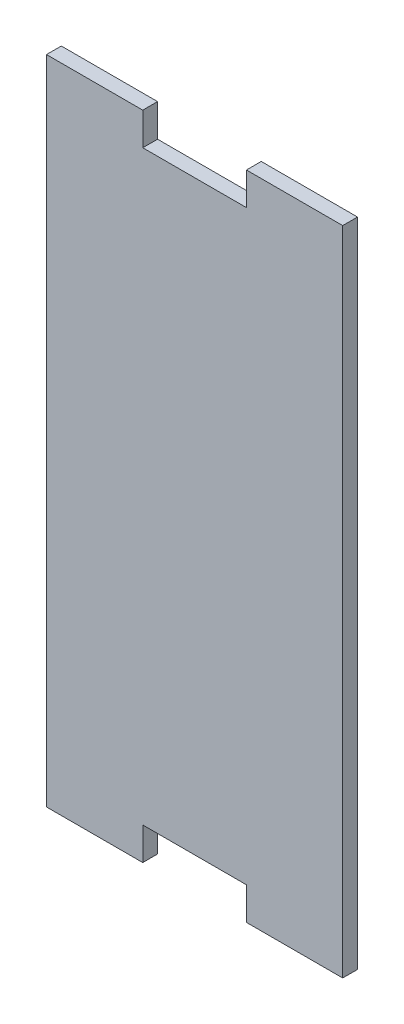
from build123d import *

# Parameters (mm, degrees)
SKETCH2_W           = 10
SKETCH2_H           = 22
BOSS_EXTRUDE1_DEPTH = 0.5
SKETCH4_W           = 3.5
SKETCH4_H           = 1.1
CUT_EXTRUDE1_DEPTH  = 13.093386622


with BuildPart() as part:
    # Sketch2 → Boss-Extrude1 (new body)
    with BuildSketch(Plane.XY):
        Rectangle(SKETCH2_W, SKETCH2_H)
    extrude(amount=BOSS_EXTRUDE1_DEPTH)

    # Sketch4 → Cut-Extrude1 (cut, through all)
    with BuildSketch(Plane.XY.offset(0.5)):
        with Locations((0, 10.45)):
            Rectangle(SKETCH4_W, SKETCH4_H)
    cut_extrude1 = extrude(amount=-CUT_EXTRUDE1_DEPTH, mode=Mode.SUBTRACT)

    # Mirror2: Cut-Extrude1 across plane
    add(cut_extrude1.mirror(Plane.ZX), mode=Mode.SUBTRACT)


solid = part.part
